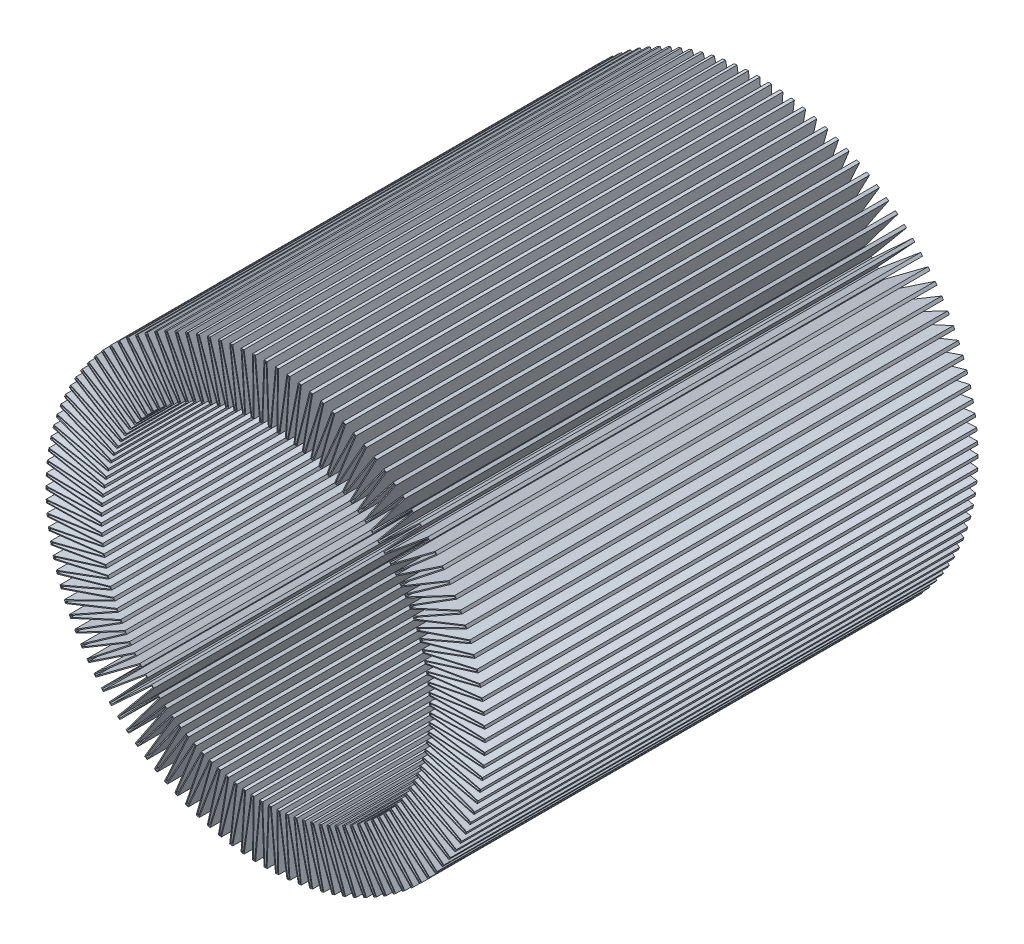
from build123d import *

# Parameters (mm, degrees)
PACK_2_DEPTH = 450


with BuildPart() as part:
    # Sketch1 → Pack 2 (new body)
    with BuildSketch(Plane.XY):
        Polygon((200.397500005, -1.384885976), (200.397500005, 1.384885976), (150.361491699, 3.312078511), (150.328767296, 4.561773028), (200.195341528, 9.105006753), (200.050382864, 11.87098283), (149.982085704, 11.176851873), (149.884002192, 12.423121064), (199.444461535, 19.569943292), (199.154941529, 22.324542144), (149.191589238, 19.01099026), (149.028415456, 20.250418188), (198.146918136, 29.981239977), (197.713630343, 32.716911441), (147.992168995, 26.793020845), (147.764352191, 28.022210324), (196.306267808, 40.310360167), (195.730399838, 43.019605957), (146.387112505, 34.501613622), (146.095277109, 35.717195529), (193.927555645, 50.528992461), (193.210685913, 53.204386723), (144.380819114, 42.115639874), (144.025765027, 43.314282384), (191.017301531, 60.6091283), (190.161394927, 63.243337964), (141.978787934, 49.614230085), (141.561488334, 50.792647802), (187.583482272, 70.52313873), (186.590884776, 73.108943611), (139.187602764, 56.976831139), (138.709201441, 58.131794103), (183.635509726, 80.24385014), (182.50894198, 82.774162726), (136.014914051, 64.18326266), (135.476722269, 65.311605196), (179.184205012, 89.744618734), (177.926754859, 92.212503614), (132.469417912, 71.21377232), (131.872910818, 72.31240172), (174.241768848, 98.999403566), (172.856882871, 101.39809644), (128.560832307, 78.049089979), (127.907644884, 79.114994977), (168.821748106, 107.982837914), (167.313222182, 110.305764131), (124.299870396, 84.670480508), (123.591792987, 85.700739531), (162.938998688, 116.670298809), (161.310967581, 118.91109139), (119.698211181, 91.059795135), (118.937184576, 92.051584316), (156.609644799, 125.037974525), (154.866570831, 127.190491612), (114.768467489, 97.199521194), (113.956577609, 98.150122107), (149.851034761, 133.062929844), (147.997695574, 135.121271539), (109.524151405, 103.07283012), (108.663623584, 103.979637235), (142.681693452, 140.723168921), (140.723168921, 142.681693452), (103.979637235, 108.663623584), (103.07283012, 109.524151405), (135.121271539, 147.997695574), (133.062929844, 149.851034761), (98.150122107, 113.956577609), (97.199521194, 114.768467489), (127.190491612, 154.866570831), (125.037974525, 156.609644799), (92.051584316, 118.937184576), (91.059795135, 119.698211181), (118.91109139, 161.310967581), (116.670298809, 162.938998688), (85.700739531, 123.591792987), (84.670480508, 124.299870396), (110.305764131, 167.313222182), (107.982837914, 168.821748106), (79.114994977, 127.907644884), (78.049089979, 128.560832307), (101.39809644, 172.856882871), (98.999403566, 174.241768848), (72.31240172, 131.872910818), (71.21377232, 132.469417912), (92.212503614, 177.926754859), (89.744618734, 179.184205012), (65.311605196, 135.476722269), (64.18326266, 136.014914051), (82.774162726, 182.50894198), (80.24385014, 183.635509726), (58.131794103, 138.709201441), (56.976831139, 139.187602764), (73.108943611, 186.590884776), (70.52313873, 187.583482272), (50.792647802, 141.561488334), (49.614230085, 141.978787934), (63.243337964, 190.161394927), (60.6091283, 191.017301531), (43.314282384, 144.025765027), (42.115639874, 144.380819114), (53.204386723, 193.210685913), (50.528992461, 193.927555645), (35.717195529, 146.095277109), (34.501613622, 146.387112505), (43.019605957, 195.730399838), (40.310360167, 196.306267808), (28.022210324, 147.764352191), (26.793020845, 147.992168995), (32.716911441, 197.713630343), (29.981239977, 198.146918136), (20.250418188, 149.028415456), (19.01099026, 149.191589238), (22.324542144, 199.154941529), (19.569943292, 199.444461535), (12.423121064, 149.884002192), (11.176851873, 149.982085704), (11.87098283, 200.050382864), (9.105006753, 200.195341528), (4.561773028, 150.328767296), (3.312078511, 150.361491699), (1.384885976, 200.397500005), (-1.384885976, 200.397500005), (-3.312078511, 150.361491699), (-4.561773028, 150.328767296), (-9.105006753, 200.195341528), (-11.87098283, 200.050382864), (-11.176851873, 149.982085704), (-12.423121064, 149.884002192), (-19.569943292, 199.444461535), (-22.324542144, 199.154941529), (-19.01099026, 149.191589238), (-20.250418188, 149.028415456), (-29.981239977, 198.146918136), (-32.716911441, 197.713630343), (-26.793020845, 147.992168995), (-28.022210324, 147.764352191), (-40.310360167, 196.306267808), (-43.019605957, 195.730399838), (-34.501613622, 146.387112505), (-35.717195529, 146.095277109), (-50.528992461, 193.927555645), (-53.204386723, 193.210685913), (-42.115639874, 144.380819114), (-43.314282384, 144.025765027), (-60.6091283, 191.017301531), (-63.243337964, 190.161394927), (-49.614230085, 141.978787934), (-50.792647802, 141.561488334), (-70.52313873, 187.583482272), (-73.108943611, 186.590884776), (-56.976831139, 139.187602764), (-58.131794103, 138.709201441), (-80.24385014, 183.635509726), (-82.774162726, 182.50894198), (-64.18326266, 136.014914051), (-65.311605196, 135.476722269), (-89.744618734, 179.184205012), (-92.212503614, 177.926754859), (-71.21377232, 132.469417912), (-72.31240172, 131.872910818), (-98.999403566, 174.241768848), (-101.39809644, 172.856882871), (-78.049089979, 128.560832307), (-79.114994977, 127.907644884), (-107.982837914, 168.821748106), (-110.305764131, 167.313222182), (-84.670480508, 124.299870396), (-85.700739531, 123.591792987), (-116.670298809, 162.938998688), (-118.91109139, 161.310967581), (-91.059795135, 119.698211181), (-92.051584316, 118.937184576), (-125.037974525, 156.609644799), (-127.190491612, 154.866570831), (-97.199521194, 114.768467489), (-98.150122107, 113.956577609), (-133.062929844, 149.851034761), (-135.121271539, 147.997695574), (-103.07283012, 109.524151405), (-103.979637235, 108.663623584), (-140.723168921, 142.681693452), (-142.681693452, 140.723168921), (-108.663623584, 103.979637235), (-109.524151405, 103.07283012), (-147.997695574, 135.121271539), (-149.851034761, 133.062929844), (-113.956577609, 98.150122107), (-114.768467489, 97.199521194), (-154.866570831, 127.190491612), (-156.609644799, 125.037974525), (-118.937184576, 92.051584316), (-119.698211181, 91.059795135), (-161.310967581, 118.91109139), (-162.938998688, 116.670298809), (-123.591792987, 85.700739531), (-124.299870396, 84.670480508), (-167.313222182, 110.305764131), (-168.821748106, 107.982837914), (-127.907644884, 79.114994977), (-128.560832307, 78.049089979), (-172.856882871, 101.39809644), (-174.241768848, 98.999403566), (-131.872910818, 72.31240172), (-132.469417912, 71.21377232), (-177.926754859, 92.212503614), (-179.184205012, 89.744618734), (-135.476722269, 65.311605196), (-136.014914051, 64.18326266), (-182.50894198, 82.774162726), (-183.635509726, 80.24385014), (-138.709201441, 58.131794103), (-139.187602764, 56.976831139), (-186.590884776, 73.108943611), (-187.583482272, 70.52313873), (-141.561488334, 50.792647802), (-141.978787934, 49.614230085), (-190.161394927, 63.243337964), (-191.017301531, 60.6091283), (-144.025765027, 43.314282384), (-144.380819114, 42.115639874), (-193.210685913, 53.204386723), (-193.927555645, 50.528992461), (-146.095277109, 35.717195529), (-146.387112505, 34.501613622), (-195.730399838, 43.019605957), (-196.306267808, 40.310360167), (-147.764352191, 28.022210324), (-147.992168995, 26.793020845), (-197.713630343, 32.716911441), (-198.146918136, 29.981239977), (-149.028415456, 20.250418188), (-149.191589238, 19.01099026), (-199.154941529, 22.324542144), (-199.444461535, 19.569943292), (-149.884002192, 12.423121064), (-149.982085704, 11.176851873), (-200.050382864, 11.87098283), (-200.195341528, 9.105006753), (-150.328767296, 4.561773028), (-150.361491699, 3.312078511), (-200.397500005, 1.384885976), (-200.397500005, -1.384885976), (-150.361491699, -3.312078511), (-150.328767296, -4.561773028), (-200.195341528, -9.105006753), (-200.050382864, -11.87098283), (-149.982085704, -11.176851873), (-149.884002192, -12.423121064), (-199.444461535, -19.569943292), (-199.154941529, -22.324542144), (-149.191589238, -19.01099026), (-149.028415456, -20.250418188), (-198.146918136, -29.981239977), (-197.713630343, -32.716911441), (-147.992168995, -26.793020845), (-147.764352191, -28.022210324), (-196.306267808, -40.310360167), (-195.730399838, -43.019605957), (-146.387112505, -34.501613622), (-146.095277109, -35.717195529), (-193.927555645, -50.528992461), (-193.210685913, -53.204386723), (-144.380819114, -42.115639874), (-144.025765027, -43.314282384), (-191.017301531, -60.6091283), (-190.161394927, -63.243337964), (-141.978787934, -49.614230085), (-141.561488334, -50.792647802), (-187.583482272, -70.52313873), (-186.590884776, -73.108943611), (-139.187602764, -56.976831139), (-138.709201441, -58.131794103), (-183.635509726, -80.24385014), (-182.50894198, -82.774162726), (-136.014914051, -64.18326266), (-135.476722269, -65.311605196), (-179.184205012, -89.744618734), (-177.926754859, -92.212503614), (-132.469417912, -71.21377232), (-131.872910818, -72.31240172), (-174.241768848, -98.999403566), (-172.856882871, -101.39809644), (-128.560832307, -78.049089979), (-127.907644884, -79.114994977), (-168.821748106, -107.982837914), (-167.313222182, -110.305764131), (-124.299870396, -84.670480508), (-123.591792987, -85.700739531), (-162.938998688, -116.670298809), (-161.310967581, -118.91109139), (-119.698211181, -91.059795135), (-118.937184576, -92.051584316), (-156.609644799, -125.037974525), (-154.866570831, -127.190491612), (-114.768467489, -97.199521194), (-113.956577609, -98.150122107), (-149.851034761, -133.062929844), (-147.997695574, -135.121271539), (-109.524151405, -103.07283012), (-108.663623584, -103.979637235), (-142.681693452, -140.723168921), (-140.723168921, -142.681693452), (-103.979637235, -108.663623584), (-103.07283012, -109.524151405), (-135.121271539, -147.997695574), (-133.062929844, -149.851034761), (-98.150122107, -113.956577609), (-97.199521194, -114.768467489), (-127.190491612, -154.866570831), (-125.037974525, -156.609644799), (-92.051584316, -118.937184576), (-91.059795135, -119.698211181), (-118.91109139, -161.310967581), (-116.670298809, -162.938998688), (-85.700739531, -123.591792987), (-84.670480508, -124.299870396), (-110.305764131, -167.313222182), (-107.982837914, -168.821748106), (-79.114994977, -127.907644884), (-78.049089979, -128.560832307), (-101.39809644, -172.856882871), (-98.999403566, -174.241768848), (-72.31240172, -131.872910818), (-71.21377232, -132.469417912), (-92.212503614, -177.926754859), (-89.744618734, -179.184205012), (-65.311605196, -135.476722269), (-64.18326266, -136.014914051), (-82.774162726, -182.50894198), (-80.24385014, -183.635509726), (-58.131794103, -138.709201441), (-56.976831139, -139.187602764), (-73.108943611, -186.590884776), (-70.52313873, -187.583482272), (-50.792647802, -141.561488334), (-49.614230085, -141.978787934), (-63.243337964, -190.161394927), (-60.6091283, -191.017301531), (-43.314282384, -144.025765027), (-42.115639874, -144.380819114), (-53.204386723, -193.210685913), (-50.528992461, -193.927555645), (-35.717195529, -146.095277109), (-34.501613622, -146.387112505), (-43.019605957, -195.730399838), (-40.310360167, -196.306267808), (-28.022210324, -147.764352191), (-26.793020845, -147.992168995), (-32.716911441, -197.713630343), (-29.981239977, -198.146918136), (-20.250418188, -149.028415456), (-19.01099026, -149.191589238), (-22.324542144, -199.154941529), (-19.569943292, -199.444461535), (-12.423121064, -149.884002192), (-11.176851873, -149.982085704), (-11.87098283, -200.050382864), (-9.105006753, -200.195341528), (-4.561773028, -150.328767296), (-3.312078511, -150.361491699), (-1.384885976, -200.397500005), (1.384885976, -200.397500005), (3.312078511, -150.361491699), (4.561773028, -150.328767296), (9.105006753, -200.195341528), (11.87098283, -200.050382864), (11.176851873, -149.982085704), (12.423121064, -149.884002192), (19.569943292, -199.444461535), (22.324542144, -199.154941529), (19.01099026, -149.191589238), (20.250418188, -149.028415456), (29.981239977, -198.146918136), (32.716911441, -197.713630343), (26.793020845, -147.992168995), (28.022210324, -147.764352191), (40.310360167, -196.306267808), (43.019605957, -195.730399838), (34.501613622, -146.387112505), (35.717195529, -146.095277109), (50.528992461, -193.927555645), (53.204386723, -193.210685913), (42.115639874, -144.380819114), (43.314282384, -144.025765027), (60.6091283, -191.017301531), (63.243337964, -190.161394927), (49.614230085, -141.978787934), (50.792647802, -141.561488334), (70.52313873, -187.583482272), (73.108943611, -186.590884776), (56.976831139, -139.187602764), (58.131794103, -138.709201441), (80.24385014, -183.635509726), (82.774162726, -182.50894198), (64.18326266, -136.014914051), (65.311605196, -135.476722269), (89.744618734, -179.184205012), (92.212503614, -177.926754859), (71.21377232, -132.469417912), (72.31240172, -131.872910818), (98.999403566, -174.241768848), (101.39809644, -172.856882871), (78.049089979, -128.560832307), (79.114994977, -127.907644884), (107.982837914, -168.821748106), (110.305764131, -167.313222182), (84.670480508, -124.299870396), (85.700739531, -123.591792987), (116.670298809, -162.938998688), (118.91109139, -161.310967581), (91.059795135, -119.698211181), (92.051584316, -118.937184576), (125.037974525, -156.609644799), (127.190491612, -154.866570831), (97.199521194, -114.768467489), (98.150122107, -113.956577609), (133.062929844, -149.851034761), (135.121271539, -147.997695574), (103.07283012, -109.524151405), (103.979637235, -108.663623584), (140.723168921, -142.681693452), (142.681693452, -140.723168921), (108.663623584, -103.979637235), (109.524151405, -103.07283012), (147.997695574, -135.121271539), (149.851034761, -133.062929844), (113.956577609, -98.150122107), (114.768467489, -97.199521194), (154.866570831, -127.190491612), (156.609644799, -125.037974525), (118.937184576, -92.051584316), (119.698211181, -91.059795135), (161.310967581, -118.91109139), (162.938998688, -116.670298809), (123.591792987, -85.700739531), (124.299870396, -84.670480508), (167.313222182, -110.305764131), (168.821748106, -107.982837914), (127.907644884, -79.114994977), (128.560832307, -78.049089979), (172.856882871, -101.39809644), (174.241768848, -98.999403566), (131.872910818, -72.31240172), (132.469417912, -71.21377232), (177.926754859, -92.212503614), (179.184205012, -89.744618734), (135.476722269, -65.311605196), (136.014914051, -64.18326266), (182.50894198, -82.774162726), (183.635509726, -80.24385014), (138.709201441, -58.131794103), (139.187602764, -56.976831139), (186.590884776, -73.108943611), (187.583482272, -70.52313873), (141.561488334, -50.792647802), (141.978787934, -49.614230085), (190.161394927, -63.243337964), (191.017301531, -60.6091283), (144.025765027, -43.314282384), (144.380819114, -42.115639874), (193.210685913, -53.204386723), (193.927555645, -50.528992461), (146.095277109, -35.717195529), (146.387112505, -34.501613622), (195.730399838, -43.019605957), (196.306267808, -40.310360167), (147.764352191, -28.022210324), (147.992168995, -26.793020845), (197.713630343, -32.716911441), (198.146918136, -29.981239977), (149.028415456, -20.250418188), (149.191589238, -19.01099026), (199.154941529, -22.324542144), (199.444461535, -19.569943292), (149.884002192, -12.423121064), (149.982085704, -11.176851873), (200.050382864, -11.87098283), (200.195341528, -9.105006753), (150.328767296, -4.561773028), (150.361491699, -3.312078511), align=None)
        Polygon((199.597500005, -0.61510569), (199.597500005, 0.61510569), (149.581394945, 2.541531629), (149.50941233, 5.290436792), (199.356150713, 9.831863317), (199.291766424, 11.060388736), (149.243385354, 10.366533889), (149.027634808, 13.107904494), (198.568380068, 20.251883871), (198.439787963, 21.475356024), (148.496310017, 18.1631222), (148.137382898, 20.889444341), (197.236347297, 30.616395418), (197.043899837, 31.831460855), (147.342216616, 25.909926655), (146.841096718, 28.613727673), (195.363703407, 40.896989554), (195.107928078, 42.100317864), (145.784268442, 33.585713803), (145.142329299, 36.259582766), (192.955581185, 51.065487884), (192.63717905, 52.253780828), (143.826735721, 41.169444843), (143.045736844, 43.806052863), (190.018581128, 61.094019262), (189.638424905, 62.264019811), (141.474983914, 48.640333297), (140.557065967, 51.232453615), (186.560753348, 70.955096179), (186.119885018, 72.103597444), (138.73545901, 55.977901979), (137.683137943, 58.518429772), (182.59157551, 80.621690109), (182.091203463, 81.745544128), (135.615669857, 63.162039122), (134.431830008, 65.64401098), (178.121926856, 90.067305591), (177.563422577, 91.163431957), (132.124167579, 70.173053506), (130.81205377, 72.589666517), (173.164058381, 99.266052849), (172.548952691, 100.331447156), (128.270522142, 76.991728428), (126.833730787, 79.336358824), (167.731559259, 108.192718756), (167.06153812, 109.224460833), (124.065296119, 83.599374374), (122.507765363, 85.865595687), (161.839319592, 116.822835941), (161.116219486, 117.818097854), (119.520015743, 89.977880246), (117.846014669, 92.159480919), (155.503489599, 125.132749853), (154.729292492, 126.088803659), (114.647139312, 96.109763002), (112.861256241, 98.200763421), (148.741435351, 133.099683595), (147.918263264, 134.013908817), (109.460023041, 101.978215578), (107.567152954, 103.972884456), (141.571691166, 140.701800357), (140.701800357, 141.571691166), (103.972884456, 107.567152954), (101.978215578, 109.460023041), (134.013908817, 147.918263264), (133.099683595, 148.741435351), (98.200763421, 112.861256241), (96.109763002, 114.647139312), (126.088803659, 154.729292492), (125.132749853, 155.503489599), (92.159480919, 117.846014669), (89.977880246, 119.520015743), (117.818097854, 161.116219486), (116.822835941, 161.839319592), (85.865595687, 122.507765363), (83.599374374, 124.065296119), (109.224460833, 167.06153812), (108.192718756, 167.731559259), (79.336358824, 126.833730787), (76.991728428, 128.270522142), (100.331447156, 172.548952691), (99.266052849, 173.164058381), (72.589666517, 130.81205377), (70.173053506, 132.124167579), (91.163431957, 177.563422577), (90.067305591, 178.121926856), (65.64401098, 134.431830008), (63.162039122, 135.615669857), (81.745544128, 182.091203463), (80.621690109, 182.59157551), (58.518429772, 137.683137943), (55.977901979, 138.73545901), (72.103597444, 186.119885018), (70.955096179, 186.560753348), (51.232453615, 140.557065967), (48.640333297, 141.474983914), (62.264019811, 189.638424905), (61.094019262, 190.018581128), (43.806052863, 143.045736844), (41.169444843, 143.826735721), (52.253780828, 192.63717905), (51.065487884, 192.955581185), (36.259582766, 145.142329299), (33.585713803, 145.784268442), (42.100317864, 195.107928078), (40.896989554, 195.363703407), (28.613727673, 146.841096718), (25.909926655, 147.342216616), (31.831460855, 197.043899837), (30.616395418, 197.236347297), (20.889444341, 148.137382898), (18.1631222, 148.496310017), (21.475356024, 198.439787963), (20.251883871, 198.568380068), (13.107904494, 149.027634808), (10.366533889, 149.243385354), (11.060388736, 199.291766424), (9.831863317, 199.356150713), (5.290436792, 149.50941233), (2.541531629, 149.581394945), (0.61510569, 199.597500005), (-0.61510569, 199.597500005), (-2.541531629, 149.581394945), (-5.290436792, 149.50941233), (-9.831863317, 199.356150713), (-11.060388736, 199.291766424), (-10.366533889, 149.243385354), (-13.107904494, 149.027634808), (-20.251883871, 198.568380068), (-21.475356024, 198.439787963), (-18.1631222, 148.496310017), (-20.889444341, 148.137382898), (-30.616395418, 197.236347297), (-31.831460855, 197.043899837), (-25.909926655, 147.342216616), (-28.613727673, 146.841096718), (-40.896989554, 195.363703407), (-42.100317864, 195.107928078), (-33.585713803, 145.784268442), (-36.259582766, 145.142329299), (-51.065487884, 192.955581185), (-52.253780828, 192.63717905), (-41.169444843, 143.826735721), (-43.806052863, 143.045736844), (-61.094019262, 190.018581128), (-62.264019811, 189.638424905), (-48.640333297, 141.474983914), (-51.232453615, 140.557065967), (-70.955096179, 186.560753348), (-72.103597444, 186.119885018), (-55.977901979, 138.73545901), (-58.518429772, 137.683137943), (-80.621690109, 182.59157551), (-81.745544128, 182.091203463), (-63.162039122, 135.615669857), (-65.64401098, 134.431830008), (-90.067305591, 178.121926856), (-91.163431957, 177.563422577), (-70.173053506, 132.124167579), (-72.589666517, 130.81205377), (-99.266052849, 173.164058381), (-100.331447156, 172.548952691), (-76.991728428, 128.270522142), (-79.336358824, 126.833730787), (-108.192718756, 167.731559259), (-109.224460833, 167.06153812), (-83.599374374, 124.065296119), (-85.865595687, 122.507765363), (-116.822835941, 161.839319592), (-117.818097854, 161.116219486), (-89.977880246, 119.520015743), (-92.159480919, 117.846014669), (-125.132749853, 155.503489599), (-126.088803659, 154.729292492), (-96.109763002, 114.647139312), (-98.200763421, 112.861256241), (-133.099683595, 148.741435351), (-134.013908817, 147.918263264), (-101.978215578, 109.460023041), (-103.972884456, 107.567152954), (-140.701800357, 141.571691166), (-141.571691166, 140.701800357), (-107.567152954, 103.972884456), (-109.460023041, 101.978215578), (-147.918263264, 134.013908817), (-148.741435351, 133.099683595), (-112.861256241, 98.200763421), (-114.647139312, 96.109763002), (-154.729292492, 126.088803659), (-155.503489599, 125.132749853), (-117.846014669, 92.159480919), (-119.520015743, 89.977880246), (-161.116219486, 117.818097854), (-161.839319592, 116.822835941), (-122.507765363, 85.865595687), (-124.065296119, 83.599374374), (-167.06153812, 109.224460833), (-167.731559259, 108.192718756), (-126.833730787, 79.336358824), (-128.270522142, 76.991728428), (-172.548952691, 100.331447156), (-173.164058381, 99.266052849), (-130.81205377, 72.589666517), (-132.124167579, 70.173053506), (-177.563422577, 91.163431957), (-178.121926856, 90.067305591), (-134.431830008, 65.64401098), (-135.615669857, 63.162039122), (-182.091203463, 81.745544128), (-182.59157551, 80.621690109), (-137.683137943, 58.518429772), (-138.73545901, 55.977901979), (-186.119885018, 72.103597444), (-186.560753348, 70.955096179), (-140.557065967, 51.232453615), (-141.474983914, 48.640333297), (-189.638424905, 62.264019811), (-190.018581128, 61.094019262), (-143.045736844, 43.806052863), (-143.826735721, 41.169444843), (-192.63717905, 52.253780828), (-192.955581185, 51.065487884), (-145.142329299, 36.259582766), (-145.784268442, 33.585713803), (-195.107928078, 42.100317864), (-195.363703407, 40.896989554), (-146.841096718, 28.613727673), (-147.342216616, 25.909926655), (-197.043899837, 31.831460855), (-197.236347297, 30.616395418), (-148.137382898, 20.889444341), (-148.496310017, 18.1631222), (-198.439787963, 21.475356024), (-198.568380068, 20.251883871), (-149.027634808, 13.107904494), (-149.243385354, 10.366533889), (-199.291766424, 11.060388736), (-199.356150713, 9.831863317), (-149.50941233, 5.290436792), (-149.581394945, 2.541531629), (-199.597500005, 0.61510569), (-199.597500005, -0.61510569), (-149.581394945, -2.541531629), (-149.50941233, -5.290436792), (-199.356150713, -9.831863317), (-199.291766424, -11.060388736), (-149.243385354, -10.366533889), (-149.027634808, -13.107904494), (-198.568380068, -20.251883871), (-198.439787963, -21.475356024), (-148.496310017, -18.1631222), (-148.137382898, -20.889444341), (-197.236347297, -30.616395418), (-197.043899837, -31.831460855), (-147.342216616, -25.909926655), (-146.841096718, -28.613727673), (-195.363703407, -40.896989554), (-195.107928078, -42.100317864), (-145.784268442, -33.585713803), (-145.142329299, -36.259582766), (-192.955581185, -51.065487884), (-192.63717905, -52.253780828), (-143.826735721, -41.169444843), (-143.045736844, -43.806052863), (-190.018581128, -61.094019262), (-189.638424905, -62.264019811), (-141.474983914, -48.640333297), (-140.557065967, -51.232453615), (-186.560753348, -70.955096179), (-186.119885018, -72.103597444), (-138.73545901, -55.977901979), (-137.683137943, -58.518429772), (-182.59157551, -80.621690109), (-182.091203463, -81.745544128), (-135.615669857, -63.162039122), (-134.431830008, -65.64401098), (-178.121926856, -90.067305591), (-177.563422577, -91.163431957), (-132.124167579, -70.173053506), (-130.81205377, -72.589666517), (-173.164058381, -99.266052849), (-172.548952691, -100.331447156), (-128.270522142, -76.991728428), (-126.833730787, -79.336358824), (-167.731559259, -108.192718756), (-167.06153812, -109.224460833), (-124.065296119, -83.599374374), (-122.507765363, -85.865595687), (-161.839319592, -116.822835941), (-161.116219486, -117.818097854), (-119.520015743, -89.977880246), (-117.846014669, -92.159480919), (-155.503489599, -125.132749853), (-154.729292492, -126.088803659), (-114.647139312, -96.109763002), (-112.861256241, -98.200763421), (-148.741435351, -133.099683595), (-147.918263264, -134.013908817), (-109.460023041, -101.978215578), (-107.567152954, -103.972884456), (-141.571691166, -140.701800357), (-140.701800357, -141.571691166), (-103.972884456, -107.567152954), (-101.978215578, -109.460023041), (-134.013908817, -147.918263264), (-133.099683595, -148.741435351), (-98.200763421, -112.861256241), (-96.109763002, -114.647139312), (-126.088803659, -154.729292492), (-125.132749853, -155.503489599), (-92.159480919, -117.846014669), (-89.977880246, -119.520015743), (-117.818097854, -161.116219486), (-116.822835941, -161.839319592), (-85.865595687, -122.507765363), (-83.599374374, -124.065296119), (-109.224460833, -167.06153812), (-108.192718756, -167.731559259), (-79.336358824, -126.833730787), (-76.991728428, -128.270522142), (-100.331447156, -172.548952691), (-99.266052849, -173.164058381), (-72.589666517, -130.81205377), (-70.173053506, -132.124167579), (-91.163431957, -177.563422577), (-90.067305591, -178.121926856), (-65.64401098, -134.431830008), (-63.162039122, -135.615669857), (-81.745544128, -182.091203463), (-80.621690109, -182.59157551), (-58.518429772, -137.683137943), (-55.977901979, -138.73545901), (-72.103597444, -186.119885018), (-70.955096179, -186.560753348), (-51.232453615, -140.557065967), (-48.640333297, -141.474983914), (-62.264019811, -189.638424905), (-61.094019262, -190.018581128), (-43.806052863, -143.045736844), (-41.169444843, -143.826735721), (-52.253780828, -192.63717905), (-51.065487884, -192.955581185), (-36.259582766, -145.142329299), (-33.585713803, -145.784268442), (-42.100317864, -195.107928078), (-40.896989554, -195.363703407), (-28.613727673, -146.841096718), (-25.909926655, -147.342216616), (-31.831460855, -197.043899837), (-30.616395418, -197.236347297), (-20.889444341, -148.137382898), (-18.1631222, -148.496310017), (-21.475356024, -198.439787963), (-20.251883871, -198.568380068), (-13.107904494, -149.027634808), (-10.366533889, -149.243385354), (-11.060388736, -199.291766424), (-9.831863317, -199.356150713), (-5.290436792, -149.50941233), (-2.541531629, -149.581394945), (-0.61510569, -199.597500005), (0.61510569, -199.597500005), (2.541531629, -149.581394945), (5.290436792, -149.50941233), (9.831863317, -199.356150713), (11.060388736, -199.291766424), (10.366533889, -149.243385354), (13.107904494, -149.027634808), (20.251883871, -198.568380068), (21.475356024, -198.439787963), (18.1631222, -148.496310017), (20.889444341, -148.137382898), (30.616395418, -197.236347297), (31.831460855, -197.043899837), (25.909926655, -147.342216616), (28.613727673, -146.841096718), (40.896989554, -195.363703407), (42.100317864, -195.107928078), (33.585713803, -145.784268442), (36.259582766, -145.142329299), (51.065487884, -192.955581185), (52.253780828, -192.63717905), (41.169444843, -143.826735721), (43.806052863, -143.045736844), (61.094019262, -190.018581128), (62.264019811, -189.638424905), (48.640333297, -141.474983914), (51.232453615, -140.557065967), (70.955096179, -186.560753348), (72.103597444, -186.119885018), (55.977901979, -138.73545901), (58.518429772, -137.683137943), (80.621690109, -182.59157551), (81.745544128, -182.091203463), (63.162039122, -135.615669857), (65.64401098, -134.431830008), (90.067305591, -178.121926856), (91.163431957, -177.563422577), (70.173053506, -132.124167579), (72.589666517, -130.81205377), (99.266052849, -173.164058381), (100.331447156, -172.548952691), (76.991728428, -128.270522142), (79.336358824, -126.833730787), (108.192718756, -167.731559259), (109.224460833, -167.06153812), (83.599374374, -124.065296119), (85.865595687, -122.507765363), (116.822835941, -161.839319592), (117.818097854, -161.116219486), (89.977880246, -119.520015743), (92.159480919, -117.846014669), (125.132749853, -155.503489599), (126.088803659, -154.729292492), (96.109763002, -114.647139312), (98.200763421, -112.861256241), (133.099683595, -148.741435351), (134.013908817, -147.918263264), (101.978215578, -109.460023041), (103.972884456, -107.567152954), (140.701800357, -141.571691166), (141.571691166, -140.701800357), (107.567152954, -103.972884456), (109.460023041, -101.978215578), (147.918263264, -134.013908817), (148.741435351, -133.099683595), (112.861256241, -98.200763421), (114.647139312, -96.109763002), (154.729292492, -126.088803659), (155.503489599, -125.132749853), (117.846014669, -92.159480919), (119.520015743, -89.977880246), (161.116219486, -117.818097854), (161.839319592, -116.822835941), (122.507765363, -85.865595687), (124.065296119, -83.599374374), (167.06153812, -109.224460833), (167.731559259, -108.192718756), (126.833730787, -79.336358824), (128.270522142, -76.991728428), (172.548952691, -100.331447156), (173.164058381, -99.266052849), (130.81205377, -72.589666517), (132.124167579, -70.173053506), (177.563422577, -91.163431957), (178.121926856, -90.067305591), (134.431830008, -65.64401098), (135.615669857, -63.162039122), (182.091203463, -81.745544128), (182.59157551, -80.621690109), (137.683137943, -58.518429772), (138.73545901, -55.977901979), (186.119885018, -72.103597444), (186.560753348, -70.955096179), (140.557065967, -51.232453615), (141.474983914, -48.640333297), (189.638424905, -62.264019811), (190.018581128, -61.094019262), (143.045736844, -43.806052863), (143.826735721, -41.169444843), (192.63717905, -52.253780828), (192.955581185, -51.065487884), (145.142329299, -36.259582766), (145.784268442, -33.585713803), (195.107928078, -42.100317864), (195.363703407, -40.896989554), (146.841096718, -28.613727673), (147.342216616, -25.909926655), (197.043899837, -31.831460855), (197.236347297, -30.616395418), (148.137382898, -20.889444341), (148.496310017, -18.1631222), (198.439787963, -21.475356024), (198.568380068, -20.251883871), (149.027634808, -13.107904494), (149.243385354, -10.366533889), (199.291766424, -11.060388736), (199.356150713, -9.831863317), (149.50941233, -5.290436792), (149.581394945, -2.541531629), align=None, mode=Mode.SUBTRACT)
    extrude(amount=PACK_2_DEPTH)


solid = part.part
